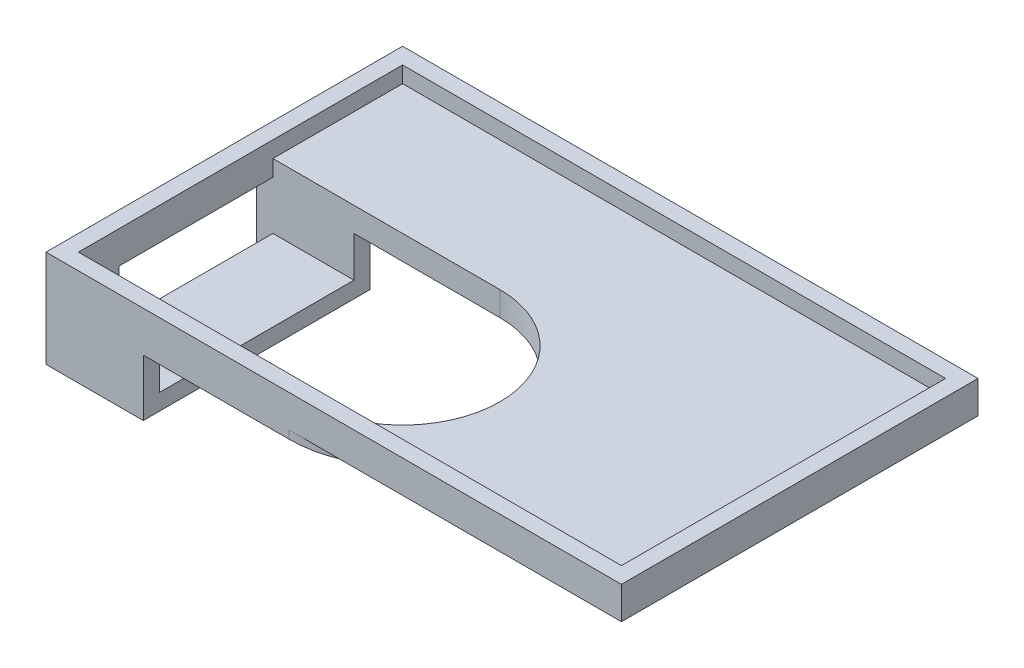
from build123d import *

# Parameters (mm, degrees)
SKETCH1_W           = 67
SKETCH1_H           = 40
BOSS_EXTRUDE1_DEPTH = 2
SKETCH1_3_W         = 71
SKETCH1_3_H         = 44
SKETCH1_3_W_2       = 67
SKETCH1_3_H_2       = 40
BOSS_EXTRUDE2_DEPTH = 4
SKETCH1_5_W         = 28
SKETCH1_5_H         = 24
CUT_EXTRUDE4_DEPTH  = 2
SKETCH2_W           = 12
SKETCH2_H           = 2
BOSS_EXTRUDE3_DEPTH = 8
SKETCH3_W           = 10
SKETCH3_H           = 2
BOSS_EXTRUDE4_DEPTH = 24
BOSS_EXTRUDE5_START = 1
BOSS_EXTRUDE5_DEPTH = 1


with BuildPart() as part:
    # Sketch1 → Boss-Extrude1 (new body)
    with BuildSketch(Plane(origin=(0, 0, 0), x_dir=(1, 0, 0), z_dir=(0, 1, 0))):
        with Locations((33.5, -20)):
            Rectangle(SKETCH1_W, SKETCH1_H)
    extrude(amount=BOSS_EXTRUDE1_DEPTH)

    # Sketch1<3> → Boss-Extrude2 (add)
    with BuildSketch(Plane(origin=(0, 0, 0), x_dir=(1, 0, 0), z_dir=(0, 1, 0))):
        with Locations((33.5, -20)):
            Rectangle(SKETCH1_3_W, SKETCH1_3_H)
        with Locations((33.5, -20)):
            Rectangle(SKETCH1_3_W_2, SKETCH1_3_H_2, mode=Mode.SUBTRACT)
    extrude(amount=BOSS_EXTRUDE2_DEPTH)

    # Sketch1<5> → Cut-Extrude4 (cut)
    with BuildSketch(Plane(origin=(0, 0, 0), x_dir=(1, 0, 0), z_dir=(0, 1, 0))):
        with Locations((14, -28)):
            Rectangle(SKETCH1_5_W, SKETCH1_5_H)
        with BuildLine():
            ThreePointArc((28, -16), (40, -28), (28, -40))
            Line((28, -40), (28, -16))
        make_face()
    extrude(amount=CUT_EXTRUDE4_DEPTH, mode=Mode.SUBTRACT)

    # Sketch2 → Boss-Extrude3 (add)
    with BuildSketch(Plane.XZ):
        with Locations((4, 15)):
            Rectangle(SKETCH2_W, SKETCH2_H)
        Polygon((-2, 42), (10, 42), (10, 40), (0, 40), (0, 35), (-2, 35), (-2, 40), align=None)
    extrude(amount=BOSS_EXTRUDE3_DEPTH)

    # Sketch3 → Boss-Extrude4 (add)
    with BuildSketch(Plane(origin=(0, 0, 40), x_dir=(-1, 0, 0), z_dir=(0, 0, -1))):
        with Locations((-5, -7)):
            Rectangle(SKETCH3_W, SKETCH3_H)
    extrude(amount=BOSS_EXTRUDE4_DEPTH)

    # Sketch5 → Boss-Extrude5 (add)
    with BuildSketch(Plane.XZ.offset(BOSS_EXTRUDE5_START)):
        with BuildLine():
            Line((10, 16), (28, 16))
            ThreePointArc((28, 16), (40, 28), (28, 40))
            Line((28, 40), (10, 40))
            Line((10, 40), (10, 42))
            Line((10, 42), (28, 42))
            ThreePointArc((28, 42), (42, 28), (28, 14))
            Line((28, 14), (10, 14))
            Line((10, 14), (10, 16))
        make_face()
    extrude(amount=-BOSS_EXTRUDE5_DEPTH)


solid = part.part
